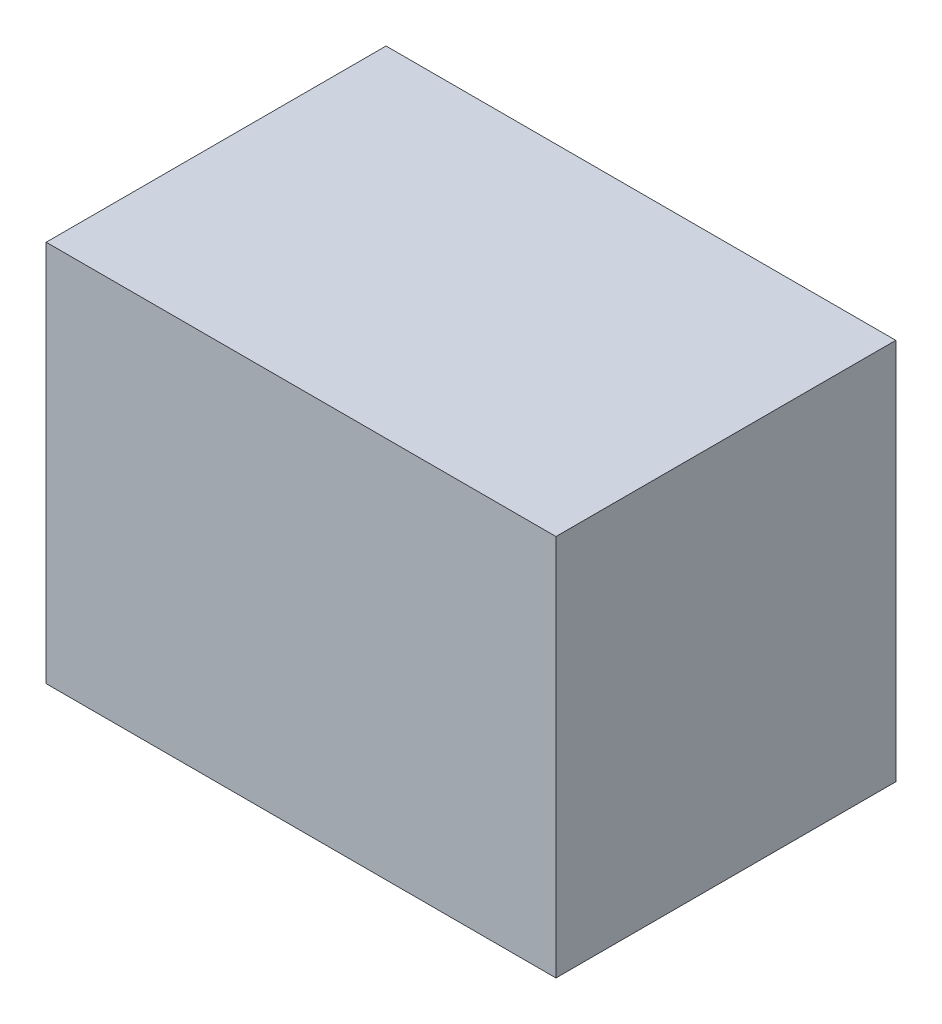
from build123d import *

# Parameters (mm, degrees)
SKETCH_1_W      = 60
SKETCH_1_H      = 40
EXTRUDE_1_DEPTH = 45


with BuildPart() as part:
    # 草图1 → 凸台-拉伸1 (new body)
    with BuildSketch(Plane(origin=(0, 0, 0), x_dir=(1, 0, 0), z_dir=(0, 1, 0))):
        Rectangle(SKETCH_1_W, SKETCH_1_H)
    extrude(amount=EXTRUDE_1_DEPTH)


solid = part.part
